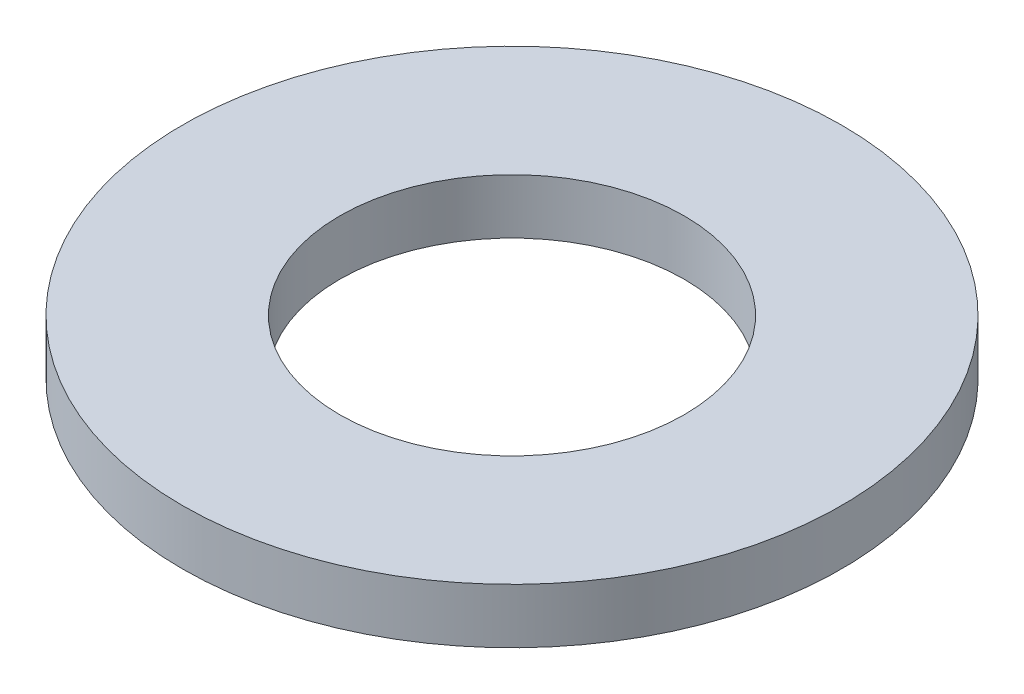
from build123d import *

# Parameters (mm, degrees)
SKETCH1_R           = 4.7625
SKETCH1_R_2         = 2.4892
BOSS_EXTRUDE1_DEPTH = 0.79375


with BuildPart() as part:
    # Sketch1 → Boss-Extrude1 (new body)
    with BuildSketch(Plane(origin=(0, 0, 0), x_dir=(1, 0, 0), z_dir=(0, 1, 0))):
        with Locations(Location((0, 0, 0), (0, 0, 270))):
            Circle(SKETCH1_R)
        with Locations(Location((0, 0, 0), (0, 0, 270))):
            Circle(SKETCH1_R_2, mode=Mode.SUBTRACT)
    extrude(amount=BOSS_EXTRUDE1_DEPTH)


solid = part.part
